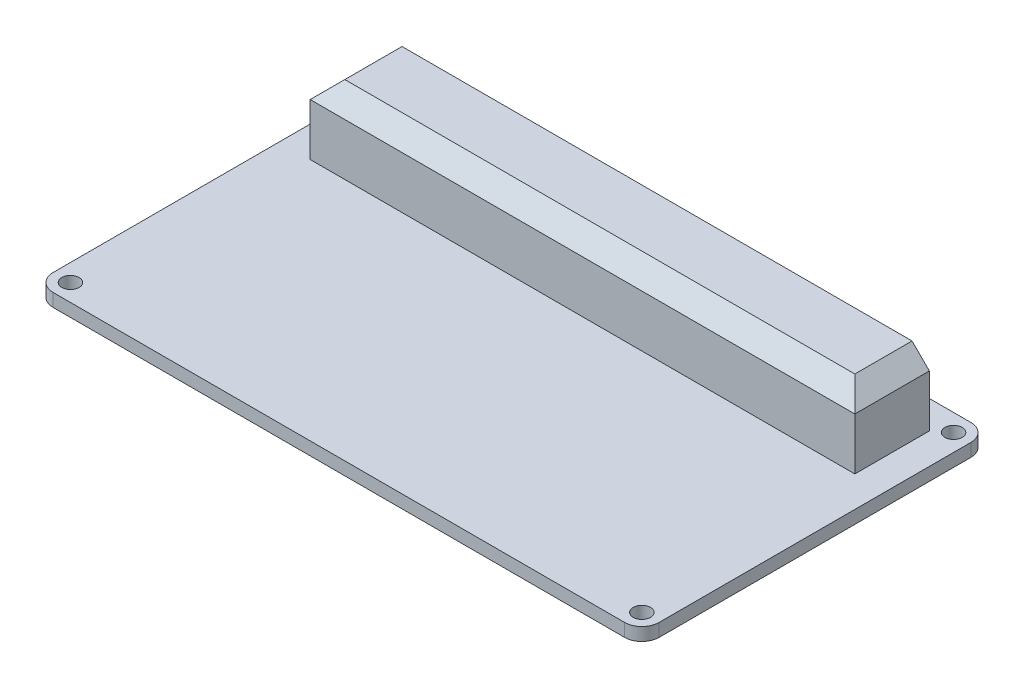
from build123d import *

# Parameters (mm, degrees)
SKETCH1_W           = 70
SKETCH1_H           = 40
BOSS_EXTRUDE1_DEPTH = 1.5
SKETCH2_W           = 62.906558998
SKETCH2_H           = 8.609060895
BOSS_EXTRUDE2_DEPTH = 8
CHAMFER1_SIZE       = 2
SKETCH3_R           = 1
CUT_EXTRUDE1_DEPTH  = 42.097445176
FILLET1_R           = 2


with BuildPart() as part:
    # Sketch1 → Boss-Extrude1 (new body)
    with BuildSketch(Plane(origin=(0, 0, 0), x_dir=(1, 0, 0), z_dir=(0, 1, 0))):
        Rectangle(SKETCH1_W, SKETCH1_H)
    extrude(amount=BOSS_EXTRUDE1_DEPTH)

    # Sketch2 → Boss-Extrude2 (add)
    with BuildSketch(Plane(origin=(0, 1.5, 0), x_dir=(1, 0, 0), z_dir=(0, 1, 0))):
        with Locations((0, 12.448226713)):
            Rectangle(SKETCH2_W, SKETCH2_H)
    extrude(amount=BOSS_EXTRUDE2_DEPTH)

    # Chamfer1
    chamfer1_edges = [part.edges().sort_by_distance(p)[0] for p in [
        (31.453279499, 9.5, -12.448226713),
        (-31.453279499, 9.5, -12.448226713),
        (0, 9.5, -8.143696265),
    ]]
    chamfer(chamfer1_edges, length=CHAMFER1_SIZE)

    # Sketch3 → Cut-Extrude1 (cut, through all)
    with BuildSketch(Plane(origin=(0, 1.5, 0), x_dir=(1, 0, 0), z_dir=(0, 1, 0))):
        with Locations(Location((-33, -18, 0), (0, 0, 270))):
            Circle(SKETCH3_R)
        with Locations(Location((-33, 18, 0), (0, 0, 270))):
            Circle(SKETCH3_R)
        with Locations(Location((33, 18, 0), (0, 0, 270))):
            Circle(SKETCH3_R)
        with Locations(Location((33, -18, 0), (0, 0, 270))):
            Circle(SKETCH3_R)
    extrude(amount=-CUT_EXTRUDE1_DEPTH, mode=Mode.SUBTRACT)

    # Fillet1
    fillet1_edges = [part.edges().sort_by_distance(p)[0] for p in [
        (35, 0.75, 20),
        (-35, 0.75, 20),
        (-35, 0.75, -20),
        (35, 0.75, -20),
    ]]
    fillet(fillet1_edges, radius=FILLET1_R)


solid = part.part
